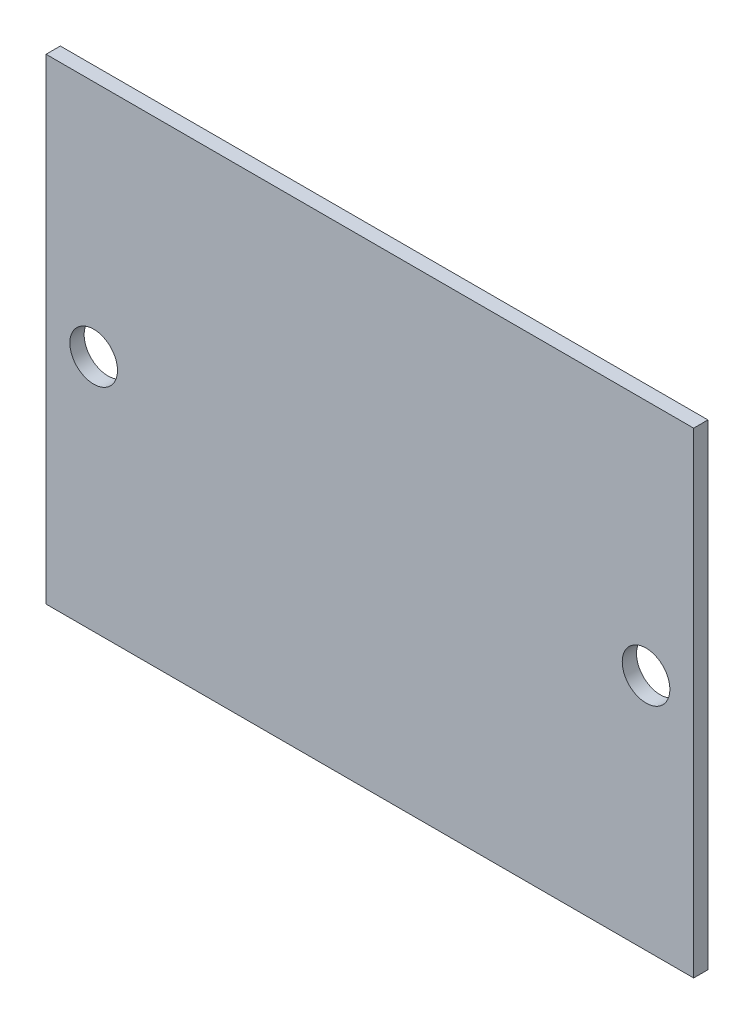
from build123d import *

# Parameters (mm, degrees)
SKETCH_1_W      = 68
SKETCH_1_H      = 50
SKETCH_1_R      = 2.5
EXTRUDE_1_DEPTH = 1.5


with BuildPart() as part:
    # ｽｹｯﾁ1 → ﾎﾞｽ - 押し出し1 (new body)
    with BuildSketch(Plane.XY):
        Rectangle(SKETCH_1_W, SKETCH_1_H)
        with Locations((-29, 0)):
            Circle(SKETCH_1_R, mode=Mode.SUBTRACT)
        with Locations(Location((29, 0, 0), (0, 0, 180))):
            Circle(SKETCH_1_R, mode=Mode.SUBTRACT)
    extrude(amount=EXTRUDE_1_DEPTH)


solid = part.part
